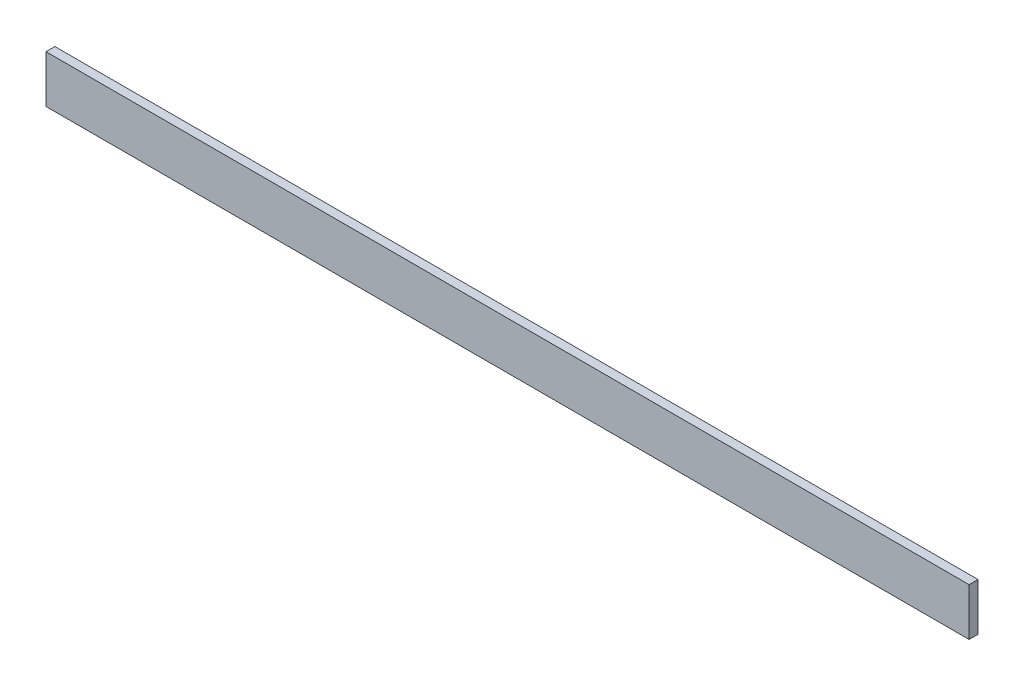
from build123d import *

# Parameters (mm, degrees)
CROQUIS1_W              = 987.6
CROQUIS1_H              = 50.8
SALIENTE_EXTRUIR1_DEPTH = 9.525


with BuildPart() as part:
    # Croquis1 → Saliente-Extruir1 (new body)
    with BuildSketch(Plane.XY):
        with Locations((493.8, 25.4)):
            Rectangle(CROQUIS1_W, CROQUIS1_H)
    extrude(amount=SALIENTE_EXTRUIR1_DEPTH)


solid = part.part
